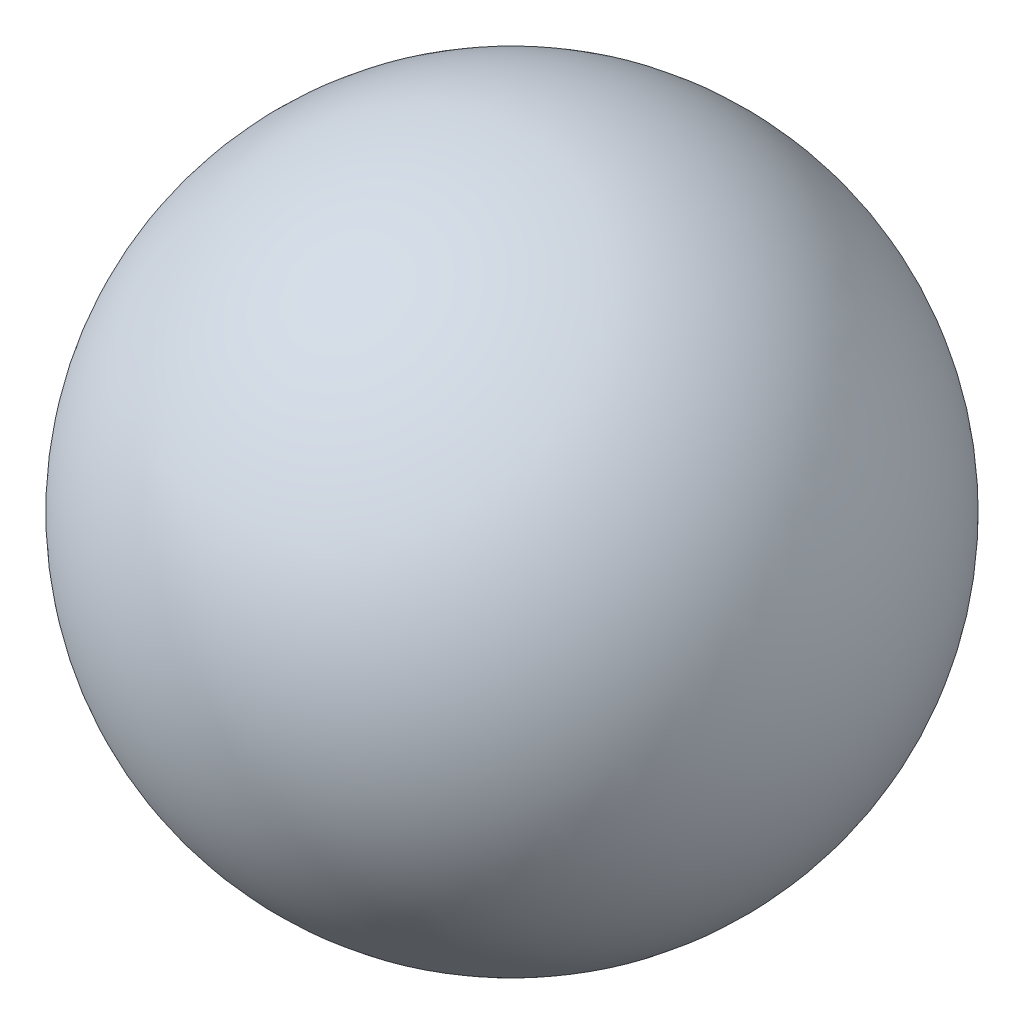
from build123d import *


with BuildPart() as part:
    # 草图1 → 旋转2 (revolve)
    with BuildSketch(Plane.XY):
        with BuildLine():
            Line((0, 2.75), (0, -2.75))
            ThreePointArc((0, -2.75), (2.75, 0), (0, 2.75))
        make_face()
    revolve(axis=Axis((0, -3.111047534, 0), (0, 1, 0)))


solid = part.part
